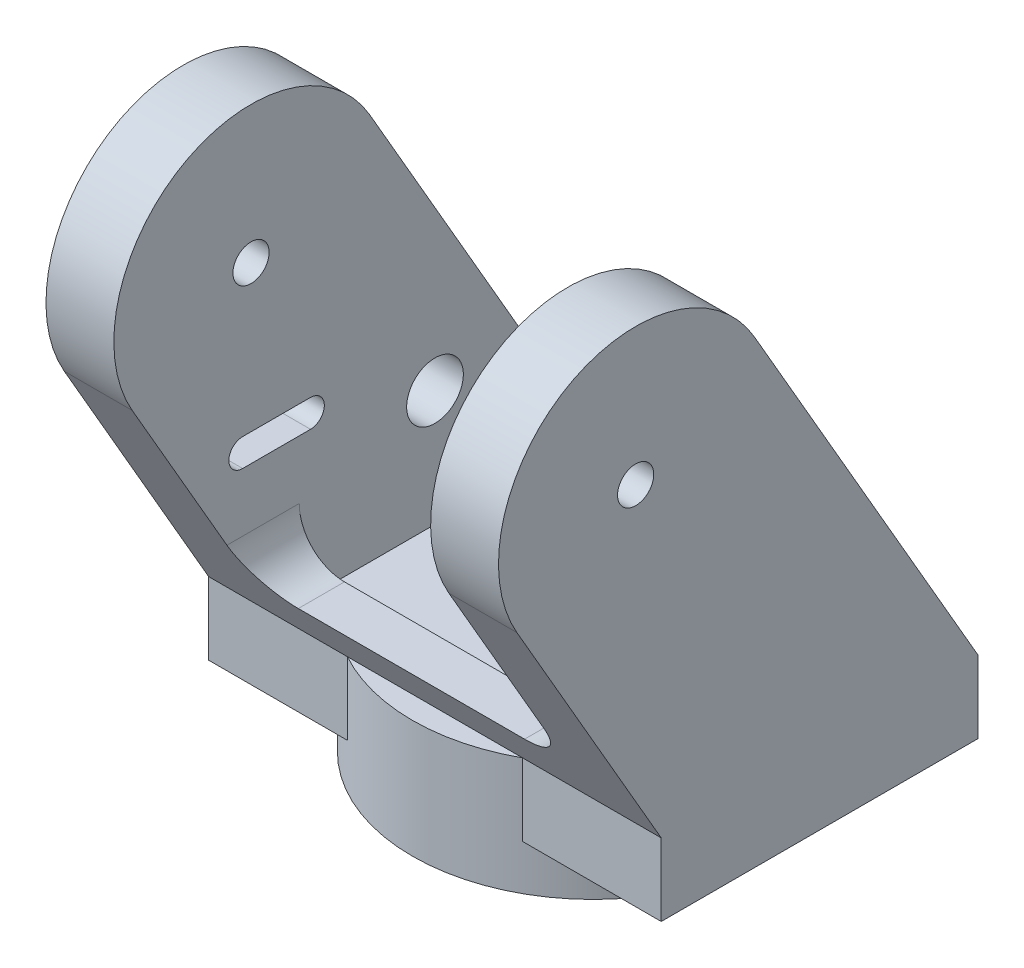
from build123d import *

# Parameters (mm, degrees)
SKETCH1_R                = 40
BOSS_EXTRUDE2_DEPTH      = 26
SKETCH3_R                = 23.5
CUT_EXTRUDE1_DEPTH       = 5
BOSS_EXTRUDE4_DEPTH      = 35
BOSS_EXTRUDE4_DEPTH_BACK = 35
SKETCH7_W                = 70
SKETCH7_H                = 16
SKETCH5_R                = 8.75
CUT_EXTRUDE9_DEPTH       = 10
SKETCH10_R               = 4
CUT_EXTRUDE10_DEPTH      = 9.4
SKETCH16_R               = 6.265
BOSS_EXTRUDE5_DEPTH      = 15
SKETCH18_R               = 4
CUT_EXTRUDE12_DEPTH      = 177.33290572
BOSS_EXTRUDE9_REACH      = 170.28
FILLET4_R                = 10
FILLET5_R                = 10
SKETCH4_R                = 1.5
CUT_EXTRUDE15_DEPTH      = 8
SKETCH25_R               = 6.265
BOSS_EXTRUDE10_DEPTH     = 15
BOSS_EXTRUDE11_DEPTH     = 15


with BuildPart() as part:
    # Sketch1 → Boss-Extrude2 (new body)
    with BuildSketch(Plane(origin=(0, 0, 0), x_dir=(1, 0, 0), z_dir=(0, 1, 0))):
        Circle(SKETCH1_R)
    extrude(amount=BOSS_EXTRUDE2_DEPTH)

    # Sketch3 → Cut-Extrude1 (cut)
    with BuildSketch(Plane.XZ):
        Circle(SKETCH3_R)
    extrude(amount=-CUT_EXTRUDE1_DEPTH, mode=Mode.SUBTRACT)

    # Sketch7 → Boss-Extrude4 (add, two sides: drawn at the far end of the back side and taken through both)
    with BuildSketch(Plane(origin=(0, 0, 0), x_dir=(0, 0, -1), z_dir=(1, 0, 0)).offset(-BOSS_EXTRUDE4_DEPTH_BACK)):
        with Locations((0, 18)):
            Rectangle(SKETCH7_W, SKETCH7_H)
    extrude(amount=BOSS_EXTRUDE4_DEPTH + BOSS_EXTRUDE4_DEPTH_BACK)

    # Sketch5 → Cut-Extrude9 (cut)
    with BuildSketch(Plane.XZ.offset(-5)):
        Circle(SKETCH5_R)
    extrude(amount=-CUT_EXTRUDE9_DEPTH, mode=Mode.SUBTRACT)

    # Sketch10 → Cut-Extrude10 (cut)
    with BuildSketch(Plane.XZ.offset(-15)):
        Circle(SKETCH10_R)
    extrude(amount=-CUT_EXTRUDE10_DEPTH, mode=Mode.SUBTRACT)

    # Sketch16 → Boss-Extrude5 (add)
    with BuildSketch(Plane.ZY.offset(35)):
        with BuildLine():
            Line((-35, 10), (-35, 26))
            Line((-35, 26), (14.400349673, 111.563915545))
            ThreePointArc((14.400349673, 111.563915545), (55.805794239, 122.658470979), (66.900349673, 81.253026413))
            Line((66.900349673, 81.253026413), (35, 26))
            Line((35, 26), (35, 10))
            Line((35, 10), (-35, 10))
        make_face()
        with Locations((0, 51.6)):
            Circle(SKETCH16_R, mode=Mode.SUBTRACT)
        with BuildLine():
            Line((27.5, 64.05), (42.5, 64.05))
            ThreePointArc((42.5, 64.05), (45.55, 61), (42.5, 57.95))
            Line((42.5, 57.95), (27.5, 57.95))
            ThreePointArc((27.5, 57.95), (24.45, 61), (27.5, 64.05))
        make_face(mode=Mode.SUBTRACT)
    boss_extrude5 = extrude(amount=BOSS_EXTRUDE5_DEPTH)

    # Mirror1: Boss-Extrude5 across plane
    add(boss_extrude5.mirror(Plane(origin=(0, 0, 0), x_dir=(0, 0, 1), z_dir=(1, 0, 0))))

    # Sketch18 → Cut-Extrude12 (cut, through all)
    with BuildSketch(Plane.ZY.offset(50)):
        with Locations((40.650349673, 96.408470979)):
            Circle(SKETCH18_R)
    extrude(amount=-CUT_EXTRUDE12_DEPTH, mode=Mode.SUBTRACT)

    # Sketch24 → Boss-Extrude9 (add, up to next)
    with BuildSketch(Plane(origin=(-35, 0, 0), x_dir=(0, 0, -1), z_dir=(1, 0, 0)), mode=Mode.PRIVATE) as boss_extrude9_sk1:
        Polygon((-40.196152423, 35), (-30, 35), (-30, 26), (-35, 26), align=None)
    boss_extrude9_tool1 = extrude(boss_extrude9_sk1.sketch, amount=BOSS_EXTRUDE9_REACH, mode=Mode.PRIVATE) - part.part
    add(boss_extrude9_tool1.solids().sort_by_distance((-35, 31.012908, 33.947102))[0])

    # Fillet4
    fillet4_edges = [part.edges().sort_by_distance(p)[0] for p in [
        (-35, 35, 35.098076211),
    ]]
    fillet(fillet4_edges, radius=FILLET4_R)

    # Fillet5
    fillet5_edges = [part.edges().sort_by_distance(p)[0] for p in [
        (35, 35, 35.098076211),
    ]]
    fillet(fillet5_edges, radius=FILLET5_R)

    # Sketch4 → Cut-Extrude15 (cut)
    with BuildSketch(Plane.XZ.offset(-5)):
        with Locations((12, 0)):
            Circle(SKETCH4_R)
        with Locations((0, -12)):
            Circle(SKETCH4_R)
        with Locations((-12, 0)):
            Circle(SKETCH4_R)
        with Locations((0, 12)):
            Circle(SKETCH4_R)
    extrude(amount=-CUT_EXTRUDE15_DEPTH, mode=Mode.SUBTRACT)

    # Sketch25 → Boss-Extrude10 (add)
    with BuildSketch(Plane.ZY.offset(-35)):
        with Locations((0, 51.6)):
            Circle(SKETCH25_R)
    extrude(amount=-BOSS_EXTRUDE10_DEPTH)

    # Sketch26 → Boss-Extrude11 (add)
    with BuildSketch(Plane.ZY.offset(-35)):
        with BuildLine():
            Line((27.5, 64.05), (42.5, 64.05))
            ThreePointArc((42.5, 64.05), (45.55, 61), (42.5, 57.95))
            Line((42.5, 57.95), (27.5, 57.95))
            ThreePointArc((27.5, 57.95), (24.45, 61), (27.5, 64.05))
        make_face()
    extrude(amount=-BOSS_EXTRUDE11_DEPTH)


solid = part.part
